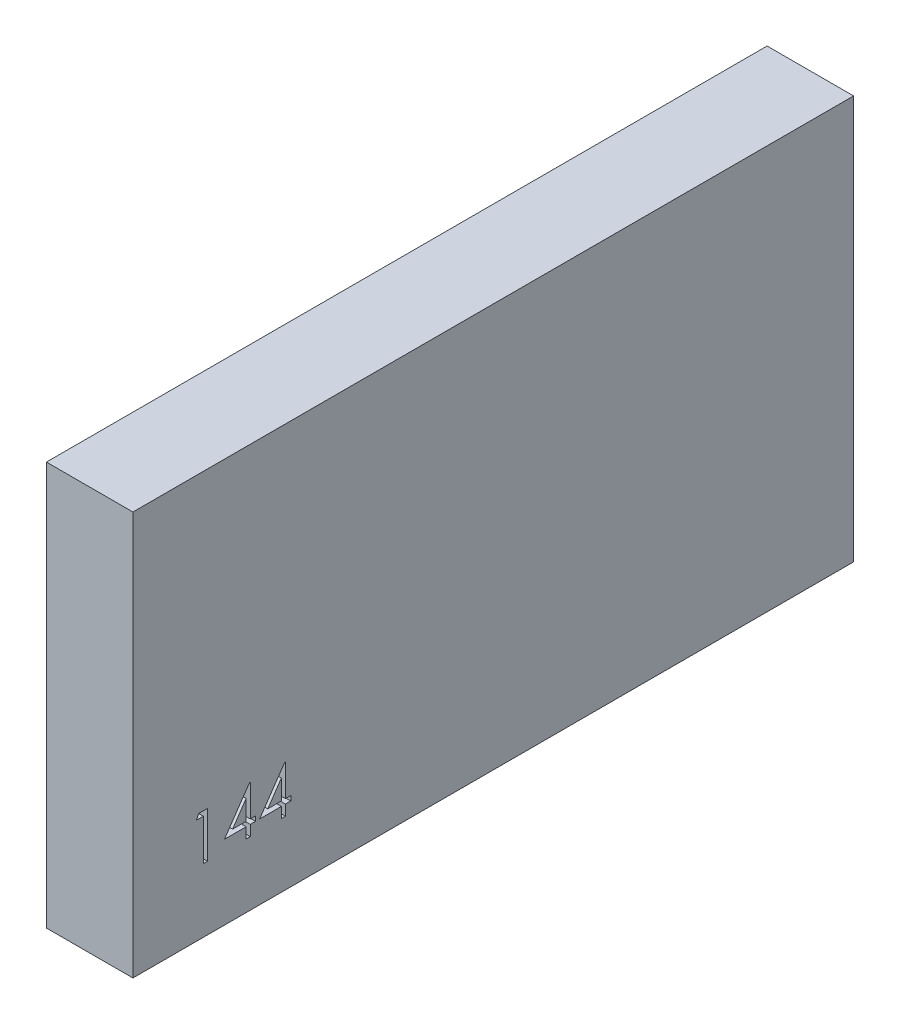
from build123d import *

# Parameters (mm, degrees)
SKETCH1_W           = 50
SKETCH1_H           = 28
BOSS_EXTRUDE1_DEPTH = 6
CUT_EXTRUDE1_DEPTH  = 1


with BuildPart() as part:
    # Sketch1 → Boss-Extrude1 (new body)
    with BuildSketch(Plane(origin=(0, 0, 0), x_dir=(0, 0, -1), z_dir=(1, 0, 0))):
        Rectangle(SKETCH1_W, SKETCH1_H)
    extrude(amount=BOSS_EXTRUDE1_DEPTH)

    # Sketch2 → Cut-Extrude1 (cut)
    # profile 1 of 3: a face of its own
    with BuildSketch(Plane(origin=(6, 0, 0), x_dir=(0, 0, -1), z_dir=(1, 0, 0))):
        Polygon((-20.415984746, -6.397614998), (-19.828940476, -6.397614998), (-19.828940476, -9.572614998), (-20.113876373, -9.572614998), (-20.113876373, -6.723256023), (-20.602337912, -6.723256023), align=None)
    # profile 2 of 3: a face of its own
    with BuildSketch(Plane(origin=(6, 0, 0), x_dir=(0, 0, -1), z_dir=(1, 0, 0))):
        Polygon((-16.915343721, -6.316204741), (-16.857466117, -6.316204741), (-16.857466117, -8.514281664), (-16.491119963, -8.514281664), (-16.491119963, -8.83992269), (-16.857466117, -8.83992269), (-16.857466117, -9.572614998), (-17.142402014, -9.572614998), (-17.142402014, -8.83992269), (-18.648491758, -8.83992269), align=None)
        Polygon((-17.142402014, -8.514281664), (-17.142402014, -7.135395446), (-18.088796245, -8.514281664), align=None, mode=Mode.SUBTRACT)
    # profile 3 of 3: a face of its own
    with BuildSketch(Plane(origin=(6, 0, 0), x_dir=(0, 0, -1), z_dir=(1, 0, 0))):
        Polygon((-14.473036029, -6.316204741), (-14.415158424, -6.316204741), (-14.415158424, -8.514281664), (-14.048812271, -8.514281664), (-14.048812271, -8.83992269), (-14.415158424, -8.83992269), (-14.415158424, -9.572614998), (-14.700094322, -9.572614998), (-14.700094322, -8.83992269), (-16.206184065, -8.83992269), align=None)
        Polygon((-14.700094322, -8.514281664), (-14.700094322, -7.135395446), (-15.646488553, -8.514281664), align=None, mode=Mode.SUBTRACT)
    extrude(amount=-CUT_EXTRUDE1_DEPTH, mode=Mode.SUBTRACT)


solid = part.part
